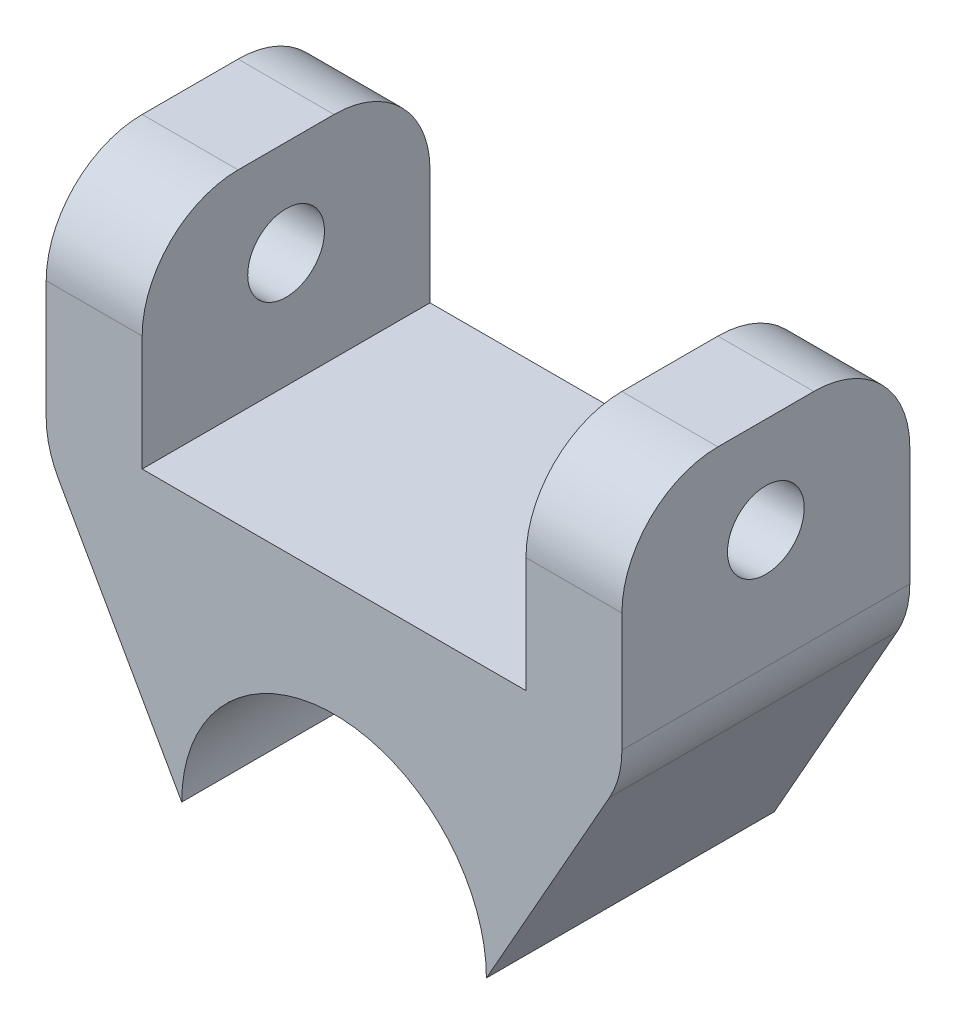
from build123d import *

# Parameters (mm, degrees)
BOSS_EXTRUDE1_DEPTH = 30
FILLET1_R           = 10
SKETCH2_R           = 4
CUT_EXTRUDE1_DEPTH  = 72.589105316
SKETCH4_W           = 40
SKETCH4_H           = 22
CUT_EXTRUDE2_DEPTH  = 50.244289009
FILLET2_R           = 10


with BuildPart() as part:
    # Sketch1 → Boss-Extrude1 (new body)
    with BuildSketch(Plane.XY):
        with BuildLine():
            Line((-15.875, 25), (-15.875, 7))
            Line((-15.875, 7), (15.875, 7))
            Line((15.875, 7), (15.875, 25))
            Line((15.875, 25), (30, 25))
            Line((30, 25), (30, 0))
            Line((30, 0), (15.875, -25))
            ThreePointArc((15.875, -25), (0, -9.125), (-15.875, -25))
            Line((-15.875, -25), (-30, 0))
            Line((-30, 0), (-30, 25))
            Line((-30, 25), (-15.875, 25))
        make_face()
    extrude(amount=BOSS_EXTRUDE1_DEPTH)

    # Fillet1
    fillet1_edges = [part.edges().sort_by_distance(p)[0] for p in [
        (-22.9375, 25, 0),
        (22.9375, 25, 0),
        (22.9375, 25, 30),
        (-22.9375, 25, 30),
    ]]
    fillet(fillet1_edges, radius=FILLET1_R)

    # Sketch2 → Cut-Extrude1 (cut, through all)
    with BuildSketch(Plane.ZY.offset(30)):
        with Locations((15, 15)):
            Circle(SKETCH2_R)
    extrude(amount=-CUT_EXTRUDE1_DEPTH, mode=Mode.SUBTRACT)

    # Sketch4 → Cut-Extrude2 (cut, through all)
    with BuildSketch(Plane.XY.offset(30)):
        with Locations((0, 14)):
            Rectangle(SKETCH4_W, SKETCH4_H)
    extrude(amount=-CUT_EXTRUDE2_DEPTH, mode=Mode.SUBTRACT)

    # Fillet2
    fillet2_edges = [part.edges().sort_by_distance(p)[0] for p in [
        (-30, 0, 15),
        (30, 0, 15),
    ]]
    fillet(fillet2_edges, radius=FILLET2_R)


solid = part.part
